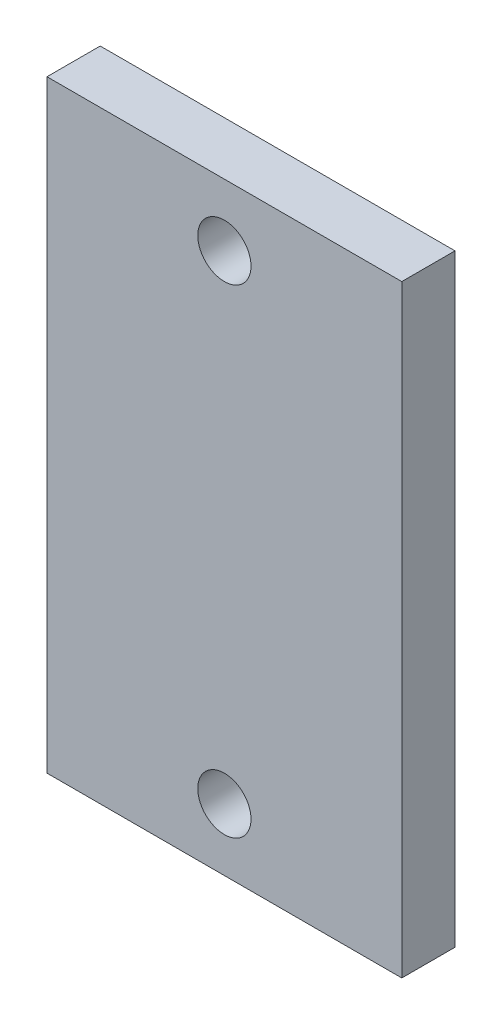
from build123d import *

# Parameters (mm, degrees)
ESQUISSE1_W        = 20
ESQUISSE1_H        = 34
ESQUISSE1_R        = 1.5
BOSS_EXTRU_1_DEPTH = 3


with BuildPart() as part:
    # Esquisse1 → Boss.-Extru.1 (new body)
    with BuildSketch(Plane.XY):
        with Locations((1.724048373, -10.153153153)):
            Rectangle(ESQUISSE1_W, ESQUISSE1_H)
        with Locations((1.724048373, 3.346846847)):
            Circle(ESQUISSE1_R, mode=Mode.SUBTRACT)
        with Locations((1.724048373, -23.653153153)):
            Circle(ESQUISSE1_R, mode=Mode.SUBTRACT)
    extrude(amount=BOSS_EXTRU_1_DEPTH)


solid = part.part
